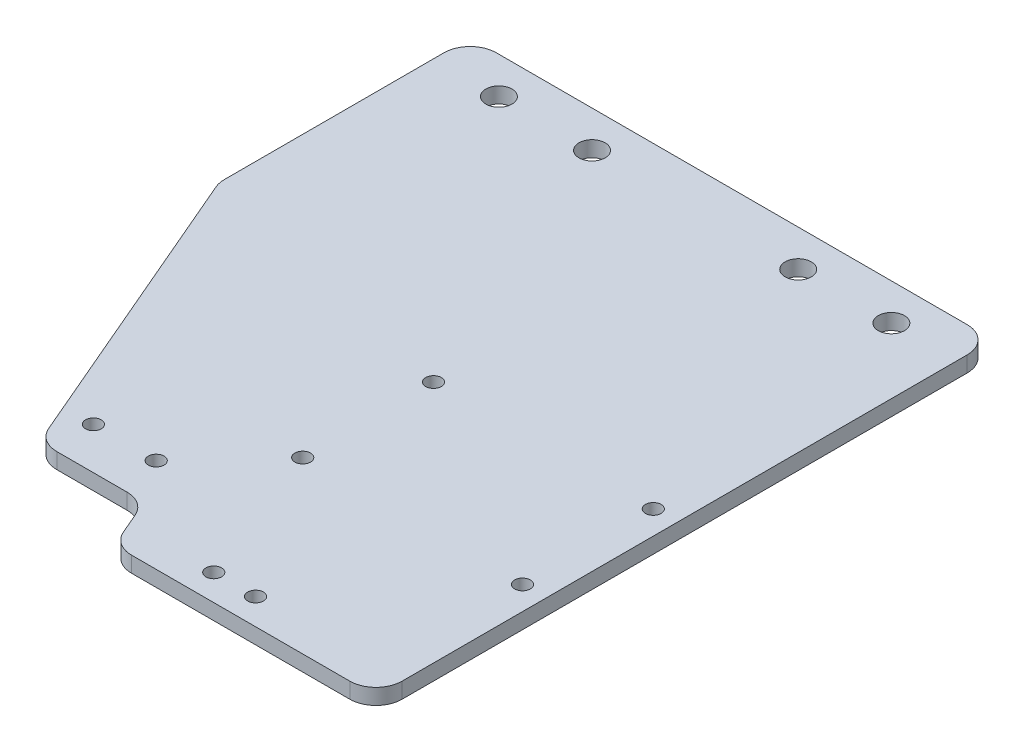
from build123d import *

# Parameters (mm, degrees)
SKETCH_1_W          = 100
SKETCH_1_H          = 118
EXTRUDE_1_DEPTH     = 3
SKETCH_3_R          = 1.5
CUT_EXTRUDE_2_DEPTH = 3
SKETCH_4_R          = 2.5
CUT_EXTRUDE_3_DEPTH = 3
SKETCH_5_R          = 1.5
CUT_EXTRUDE_4_DEPTH = 3
CUT_EXTRUDE_6_DEPTH = 3
SKETCH_9_R          = 1.5
CUT_EXTRUDE_8_DEPTH = 10
FILLET_3_R          = 5


with BuildPart() as part:
    # 草图1 → 凸台-拉伸1 (new body)
    with BuildSketch(Plane(origin=(0, 0, 0), x_dir=(1, 0, 0), z_dir=(0, 1, 0))):
        Rectangle(SKETCH_1_W, SKETCH_1_H)
    extrude(amount=EXTRUDE_1_DEPTH)

    # 草图3 → 切除-拉伸2 (cut)
    with BuildSketch(Plane(origin=(0, 3, 0), x_dir=(1, 0, 0), z_dir=(0, 1, 0))):
        with Locations((3.5, -1.5)):
            Circle(SKETCH_3_R)
        with Locations((45.5, -1.5)):
            Circle(SKETCH_3_R)
        with Locations((45.5, -26.5)):
            Circle(SKETCH_3_R)
        with Locations((3.5, -26.5)):
            Circle(SKETCH_3_R)
    extrude(amount=-CUT_EXTRUDE_2_DEPTH, mode=Mode.SUBTRACT)

    # 草图4 → 切除-拉伸3 (cut)
    with BuildSketch(Plane(origin=(0, 3, 0), x_dir=(1, 0, 0), z_dir=(0, 1, 0))):
        with Locations((37.5, 52)):
            Circle(SKETCH_4_R)
        with Locations((19.7, 52)):
            Circle(SKETCH_4_R)
        with Locations((-19.7, 52)):
            Circle(SKETCH_4_R)
        with Locations((-37.5, 52)):
            Circle(SKETCH_4_R)
    extrude(amount=-CUT_EXTRUDE_3_DEPTH, mode=Mode.SUBTRACT)

    # 草图5 → 切除-拉伸4 (cut)
    with BuildSketch(Plane(origin=(0, 3, 0), x_dir=(1, 0, 0), z_dir=(0, 1, 0))):
        with Locations((22, -54)):
            Circle(SKETCH_5_R)
        with Locations((14, -54)):
            Circle(SKETCH_5_R)
    extrude(amount=-CUT_EXTRUDE_4_DEPTH, mode=Mode.SUBTRACT)

    # 草图7 → 切除-拉伸6 (cut)
    with BuildSketch(Plane(origin=(0, 3, 0), x_dir=(1, 0, 0), z_dir=(0, 1, 0))):
        Polygon((-24.285714286, -49), (-50, 11), (-50, -59), (0, -59), (-4.285714286, -49), align=None)
    extrude(amount=-CUT_EXTRUDE_6_DEPTH, mode=Mode.SUBTRACT)

    # 草图9 → 切除-拉伸8 (cut)
    with BuildSketch(Plane(origin=(0, 3, 0), x_dir=(1, 0, 0), z_dir=(0, 1, 0))):
        with Locations((-22, -41)):
            Circle(SKETCH_9_R)
        with Locations((-10, -41)):
            Circle(SKETCH_9_R)
    extrude(amount=-CUT_EXTRUDE_8_DEPTH, mode=Mode.SUBTRACT)

    # 圆角3
    fillet_3_edges = [part.edges().sort_by_distance(p)[0] for p in [
        (-50, 1.5, -59),
        (-50, 1.5, -11),
        (-24.285714286, 1.5, 49),
        (-4.285714286, 1.5, 49),
        (0, 1.5, 59),
        (50, 1.5, 59),
        (50, 1.5, -59),
    ]]
    fillet(fillet_3_edges, radius=FILLET_3_R)


solid = part.part
